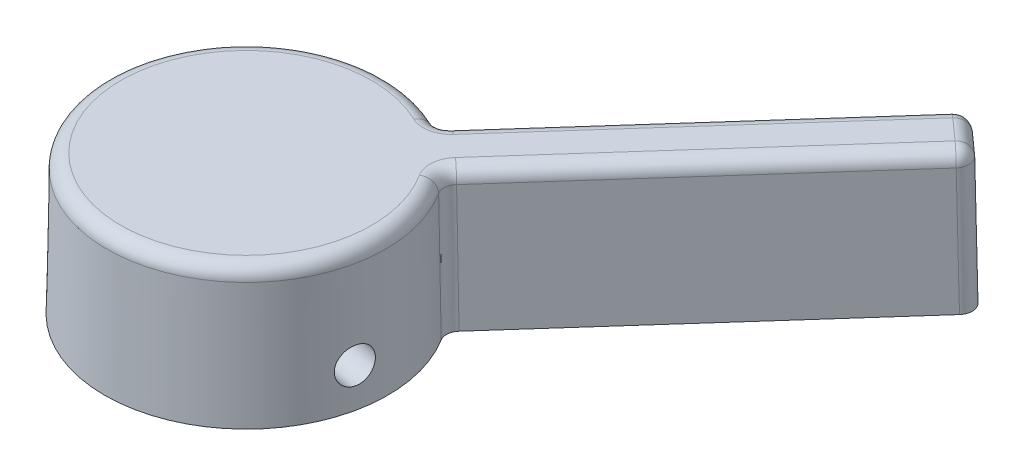
from build123d import *

# Parameters (mm, degrees)
BOSS_EXTRU_1_DEPTH      = 10
BOSS_EXTRU_1_DRAFT      = 1
PER_AGE1_D              = 13
PER_AGE1_DEPTH          = 6
CONG_1_R                = 0.991556173
CONG_2_R                = 0.991556172
CONG_3_R                = 1
ENL_V_MAT_EXTRU_1_DEPTH = 6
ESQUISSE7_R             = 2.35630159
ENL_V_MAT_EXTRU_2_DEPTH = 0.1
TROU_TARAUD_M31_D       = 2.5
TROU_TARAUD_M31_DEPTH   = 8.5
TROU_TARAUD_M31_TIP     = 0.751075774


with BuildPart() as part:
    # Esquisse1 → Boss.-Extru.1 (with draft: the straight prism first)
    with BuildSketch(Plane(origin=(0, -53.604561249, 0), x_dir=(-1, 0, 0), z_dir=(0, 1, 0))):
        with BuildLine():
            Line((4.169645588, 172.151181972), (-13.92635809, 151.841438325))
            Line((-13.92635809, 151.841438325), (-10.939855184, 149.180460987))
            Line((-10.939855184, 149.180460987), (7.156148495, 169.490204634))
            ThreePointArc((7.156148495, 169.490204634), (18.83337708, 185.602358804), (4.169645588, 172.151181972))
        make_face()
    extrude(amount=-BOSS_EXTRU_1_DEPTH)
    # Boss.-Extru.1: the draft: its side faces are tilted about the plane it starts from
    boss_extru_1_sides = [part.faces().sort_by_distance(p)[0] for p in [
        (4.878356251, -58.604561249, 161.996310148),
        (12.433106637, -58.604561249, 150.510949656),
        (1.891853345, -58.604561249, 159.33533281),
        (-18.83337708, -58.604561249, 185.602358804),
    ]]
    draft(boss_extru_1_sides, Plane(origin=(0, -53.604561249, 0), x_dir=(-1, 0, 0), z_dir=(0, 1, 0)), BOSS_EXTRU_1_DRAFT)

    # Perçage1
    with Locations(Plane.XZ.offset(63.604561249)):
        with Locations((-12.180933736, 178.136101538)):
            Hole(PER_AGE1_D / 2, depth=PER_AGE1_DEPTH)

    # Congé1
    cong_1_edges = [part.edges().sort_by_distance(p)[0] for p in [
        (-7.174076316, -58.604557662, 169.379132828),
    ]]
    fillet(cong_1_edges, radius=CONG_1_R)

    # Congé2
    cong_2_edges = [part.edges().sort_by_distance(p)[0] for p in [
        (-4.057249498, -58.604557662, 172.156228913),
    ]]
    fillet(cong_2_edges, radius=CONG_2_R)

    # Congé3
    cong_3_edges = [part.edges().sort_by_distance(p)[0] for p in [
        (14.049579508, -58.604561249, 151.834335737),
        (12.433106637, -53.604561249, 150.510949656),
        (10.932752597, -58.604561249, 149.057239569),
        (5.137318128, -53.604561249, 161.705668665),
        (2.150815222, -53.604561249, 159.044691328),
        (-3.899737977, -53.604561249, 172.149959021),
        (-7.185946015, -53.604561249, 169.221944085),
        (-18.83337708, -53.604561249, 185.602358804),
    ]]
    fillet(cong_3_edges, radius=CONG_3_R)

    # Esquisse6 → Enlèv. mat.-Extru.1 (cut)
    with BuildSketch(Plane.XZ.offset(63.604561249)):
        Polygon((-6.577094401, 183.12912848), (-8.486502447, 183.760565155), (-9.824379984, 185.262109379), (-11.793694196, 184.854245557), (-13.703102242, 185.485682232), (-15.204646466, 184.147804695), (-17.173960678, 183.739940873), (-17.805397352, 181.830532827), (-19.306941577, 180.49265529), (-18.899077755, 178.523341078), (-19.530514429, 176.613933032), (-18.192636892, 175.112388808), (-17.78477307, 173.143074596), (-15.875365024, 172.511637922), (-14.537487487, 171.010093697), (-12.568173276, 171.417957519), (-10.658765229, 170.786520845), (-9.157221005, 172.124398382), (-7.187906794, 172.532262204), (-6.556470119, 174.44167025), (-5.054925895, 175.779547787), (-5.462789717, 177.748861998), (-4.831353042, 179.658270044), (-6.169230579, 181.159814269), align=None)
    extrude(amount=-ENL_V_MAT_EXTRU_1_DEPTH, mode=Mode.SUBTRACT)

    # Esquisse7 → Enlèv. mat.-Extru.2 (cut)
    with BuildSketch(Plane.XZ.offset(57.604561249)):
        with Locations(Location((-12.180933736, 178.136101538, 0), (0, 0, 270))):
            Circle(ESQUISSE7_R)
    extrude(amount=-ENL_V_MAT_EXTRU_2_DEPTH, mode=Mode.SUBTRACT)

    # Trou taraudé M31
    with Locations(Plane(origin=(30.587175126, -0.239784127, 3.6865788), x_dir=(-0.20280563003866656, 0, 0.9792190135126153), z_dir=(-0.9792190135126153, 0, -0.20280563003866656))):
        with Locations((179.497902827, -60.604561249)):
            Hole(TROU_TARAUD_M31_D / 2, depth=TROU_TARAUD_M31_DEPTH)
            with Locations((0, 0, -(TROU_TARAUD_M31_DEPTH + TROU_TARAUD_M31_TIP / 2))):  # 118° drill point
                Cone(0, TROU_TARAUD_M31_D / 2, TROU_TARAUD_M31_TIP, mode=Mode.SUBTRACT)


solid = part.part
